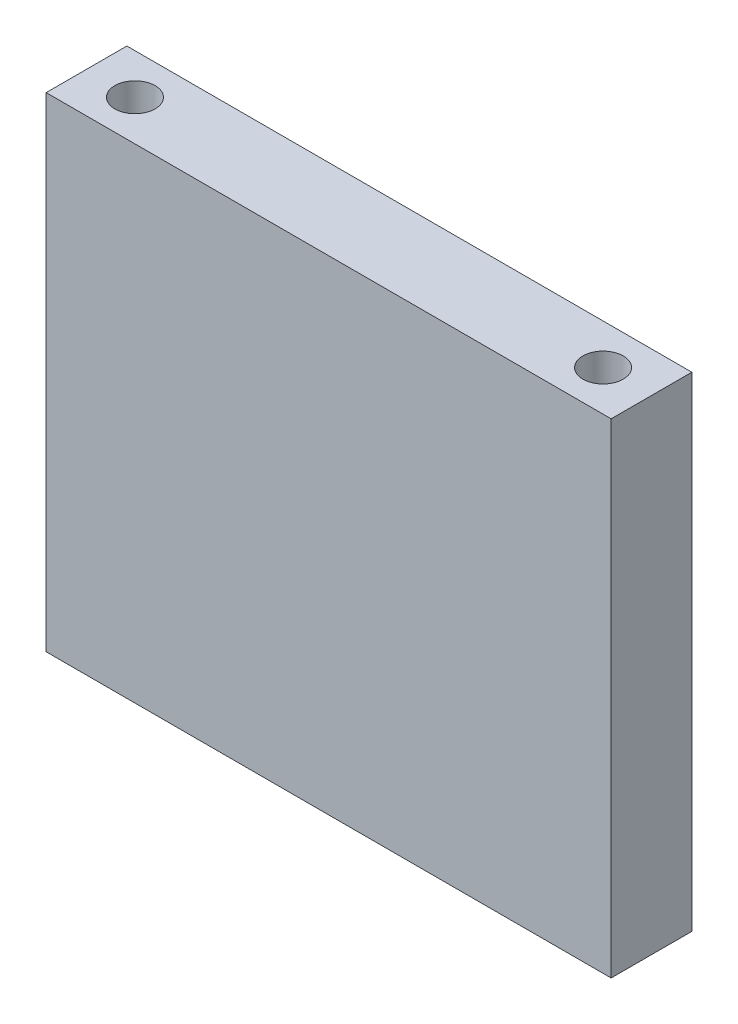
from build123d import *

# Parameters (mm, degrees)
SKETCH1_W           = 70
SKETCH1_H           = 60
BOSS_EXTRUDE1_DEPTH = 10
SKETCH3_R           = 2.5
CUT_EXTRUDE1_DEPTH  = 71.178344238


with BuildPart() as part:
    # Sketch1 → Boss-Extrude1 (new body)
    with BuildSketch(Plane.XY):
        Rectangle(SKETCH1_W, SKETCH1_H)
    extrude(amount=-BOSS_EXTRUDE1_DEPTH)

    # Sketch3 → Cut-Extrude1 (cut, through all)
    with BuildSketch(Plane(origin=(0, 30, 0), x_dir=(1, 0, 0), z_dir=(0, 1, 0))):
        with Locations(Location((-29, 5, 0), (0, 0, 180))):
            Circle(SKETCH3_R)
        with Locations(Location((29, 5, 0), (0, 0, 180))):
            Circle(SKETCH3_R)
    extrude(amount=-CUT_EXTRUDE1_DEPTH, mode=Mode.SUBTRACT)


solid = part.part
